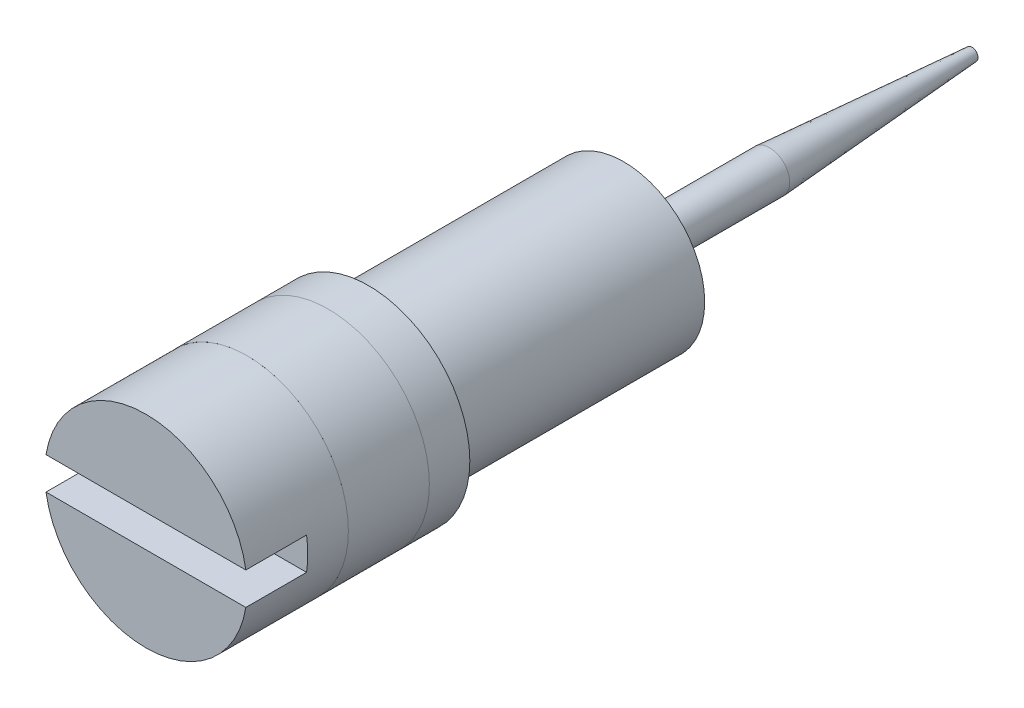
from build123d import *

# Parameters (mm, degrees)
SKETCH1_R           = 2.5
BOSS_EXTRUDE1_DEPTH = 2.5
SKETCH2_W           = 11.4011802
SKETCH2_H           = 0.8
CUT_EXTRUDE1_DEPTH  = 1.5
SKETCH3_R           = 1.65
BOSS_EXTRUDE2_DEPTH = 2
BOSS_EXTRUDE3_START = 1
SKETCH4_R           = 2.5
BOSS_EXTRUDE3_DEPTH = 1
SKETCH5_W           = 0.85
SKETCH5_H           = 2
SKETCH6_R           = 2
BOSS_EXTRUDE4_DEPTH = 6.3
SKETCH7_R           = 0.5
BOSS_EXTRUDE5_DEPTH = 3.6
SKETCH8_R           = 0.5
BOSS_EXTRUDE6_DEPTH = 5
BOSS_EXTRUDE6_TAPER = 4


with BuildPart() as part:
    # Sketch1 → Boss-Extrude1 (new body)
    with BuildSketch(Plane.XY):
        Circle(SKETCH1_R)
    extrude(amount=BOSS_EXTRUDE1_DEPTH)

    # Sketch2 → Cut-Extrude1 (cut)
    with BuildSketch(Plane.XY.offset(2.5)):
        Rectangle(SKETCH2_W, SKETCH2_H)
    extrude(amount=-CUT_EXTRUDE1_DEPTH, mode=Mode.SUBTRACT)

    # Sketch3 → Boss-Extrude2 (add)
    with BuildSketch(Plane(origin=(0, 0, 0), x_dir=(-1, 0, 0), z_dir=(0, 0, -1))):
        Circle(SKETCH3_R)
    extrude(amount=BOSS_EXTRUDE2_DEPTH)

    # Sketch4 → Boss-Extrude3 (add)
    with BuildSketch(Plane(origin=(0, 0, -2), x_dir=(-1, 0, 0), z_dir=(0, 0, -1)).offset(BOSS_EXTRUDE3_START)):
        with Locations(Location((0, 0, 0), (0, 0, 350.793103779))):
            Circle(SKETCH4_R)
    extrude(amount=-BOSS_EXTRUDE3_DEPTH)

    # Sketch6 → Boss-Extrude4 (add)
    with BuildSketch(Plane(origin=(0, 0, -3), x_dir=(-1, 0, 0), z_dir=(0, 0, -1))):
        Circle(SKETCH6_R)
    extrude(amount=BOSS_EXTRUDE4_DEPTH)

    # Sketch7 → Boss-Extrude5 (add)
    with BuildSketch(Plane(origin=(0, 0, -9.3), x_dir=(-1, 0, 0), z_dir=(0, 0, -1))):
        Circle(SKETCH7_R)
    extrude(amount=BOSS_EXTRUDE5_DEPTH)

    # Sketch8 → Boss-Extrude6 (add)
    with BuildSketch(Plane(origin=(0, 0, -12.9), x_dir=(-1, 0, 0), z_dir=(0, 0, -1))):
        with Locations(Location((0, 0, 0), (0, 0, 180))):
            Circle(SKETCH8_R)
    extrude(amount=BOSS_EXTRUDE6_DEPTH, taper=BOSS_EXTRUDE6_TAPER)


with BuildPart() as body_2:
    # Sketch5 → Revolve1 (revolve)
    with BuildSketch(Plane(origin=(0, 0, 0), x_dir=(-1, 0, 0), z_dir=(0, -1, 0)), mode=Mode.PRIVATE) as revolve1_sk:
        with Locations((-2.075, 1)):
            Rectangle(SKETCH5_W, SKETCH5_H)
    revolve(revolve1_sk.sketch.rotate(Axis((0, 0, 4.043631363), (0, 0, -1)), 170.793103779), axis=Axis((0, 0, 4.043631363), (0, 0, -1)))


solid = Compound([part.part, body_2.part])
